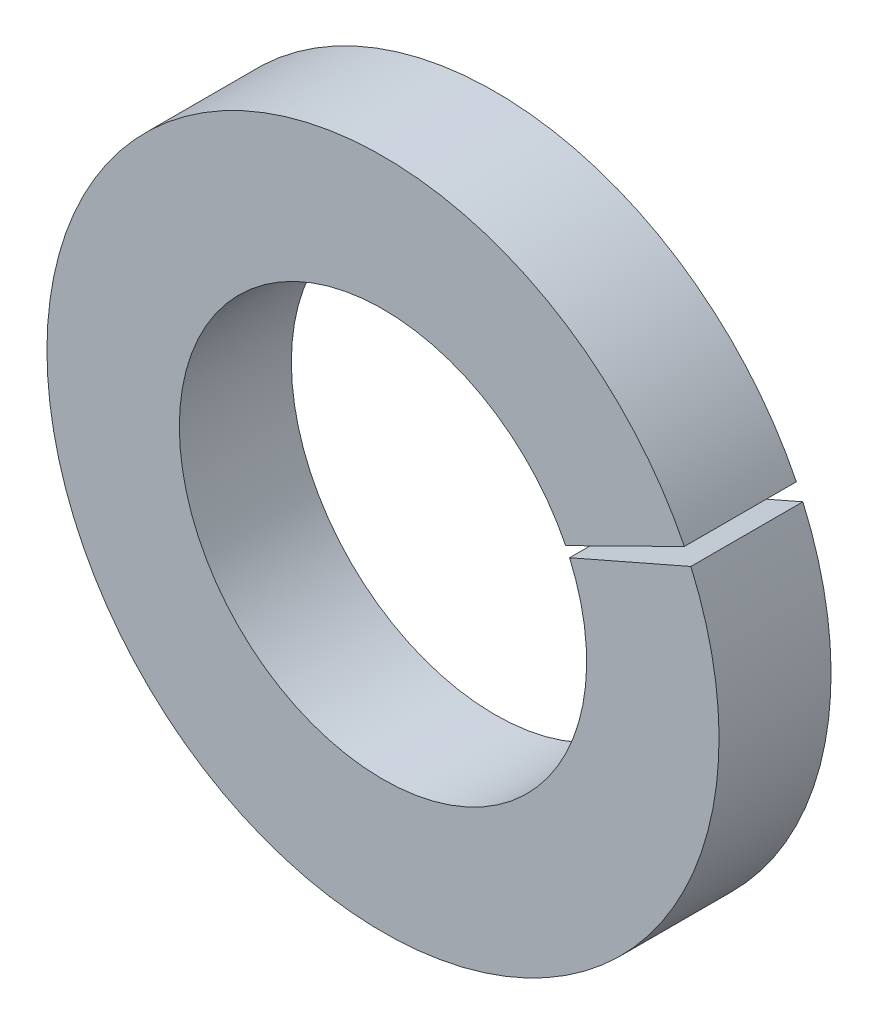
from build123d import *

# Parameters (mm, degrees)
SKETCH_1_R          = 1.65
SKETCH_1_R_2        = 1
EXTRUDE_1_DEPTH     = 0.55
CUT_EXTRUDE_1_DEPTH = 10


with BuildPart() as part:
    # 草图1 → 凸台-拉伸1 (new body)
    with BuildSketch(Plane.XY):
        Circle(SKETCH_1_R)
        Circle(SKETCH_1_R_2, mode=Mode.SUBTRACT)
    extrude(amount=EXTRUDE_1_DEPTH)

    # 草图2 → 切除-拉伸1 (cut)
    with BuildSketch(Plane.XY.offset(0.55)):
        Polygon((0, 0), (4.812459265, 2.375572201), (4.812459265, 2.105870497), align=None)
    extrude(amount=-CUT_EXTRUDE_1_DEPTH, mode=Mode.SUBTRACT)


solid = part.part
